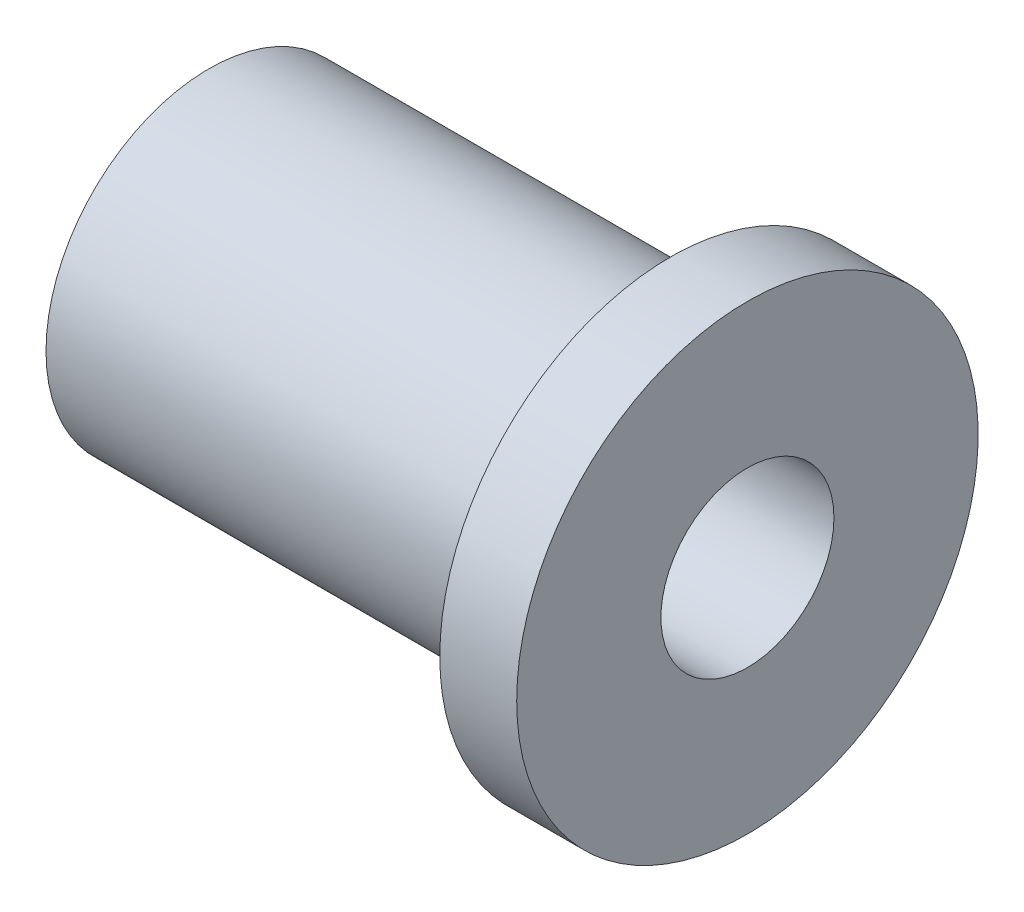
from build123d import *

# Parameters (mm, degrees)
F_9_32_0_28125_DIAMETER_HOLE1_D   = 7.14375
PIPE_TAP_DRILL_FOR_1_8_TAP2_D     = 8.4328
PIPE_TAP_DRILL_FOR_1_8_TAP2_DEPTH = 12.7
PIPE_TAP_DRILL_FOR_1_8_TAP2_TIP   = 2.533468714


with BuildPart() as part:
    # Sketch1 → Revolve1 (revolve)
    with BuildSketch(Plane.XY, mode=Mode.PRIVATE) as revolve1_sk:
        Polygon((0, 0), (0, 6.731), (19.05, 6.731), (19.05, 9.525), (22.225, 9.525), (22.225, 0), align=None)
    revolve(revolve1_sk.sketch.rotate(Axis((0, 0, 0), (1, 0, 0)), 90), axis=Axis((0, 0, 0), (1, 0, 0)))

    # 9/32 (0.28125) Diameter Hole1 (through all)
    with Locations(Plane(origin=(22.225, 0, 0), x_dir=(0, 0, -1), z_dir=(1, 0, 0))):
        with Locations((0, 0)):
            Hole(F_9_32_0_28125_DIAMETER_HOLE1_D / 2)

    # Pipe Tap Drill for 1/8 Tap2
    with Locations(Plane.ZY):
        with Locations((0, 0)):
            Hole(PIPE_TAP_DRILL_FOR_1_8_TAP2_D / 2, depth=PIPE_TAP_DRILL_FOR_1_8_TAP2_DEPTH)
            with Locations((0, 0, -(PIPE_TAP_DRILL_FOR_1_8_TAP2_DEPTH + PIPE_TAP_DRILL_FOR_1_8_TAP2_TIP / 2))):  # 118° drill point
                Cone(0, PIPE_TAP_DRILL_FOR_1_8_TAP2_D / 2, PIPE_TAP_DRILL_FOR_1_8_TAP2_TIP, mode=Mode.SUBTRACT)


solid = part.part
